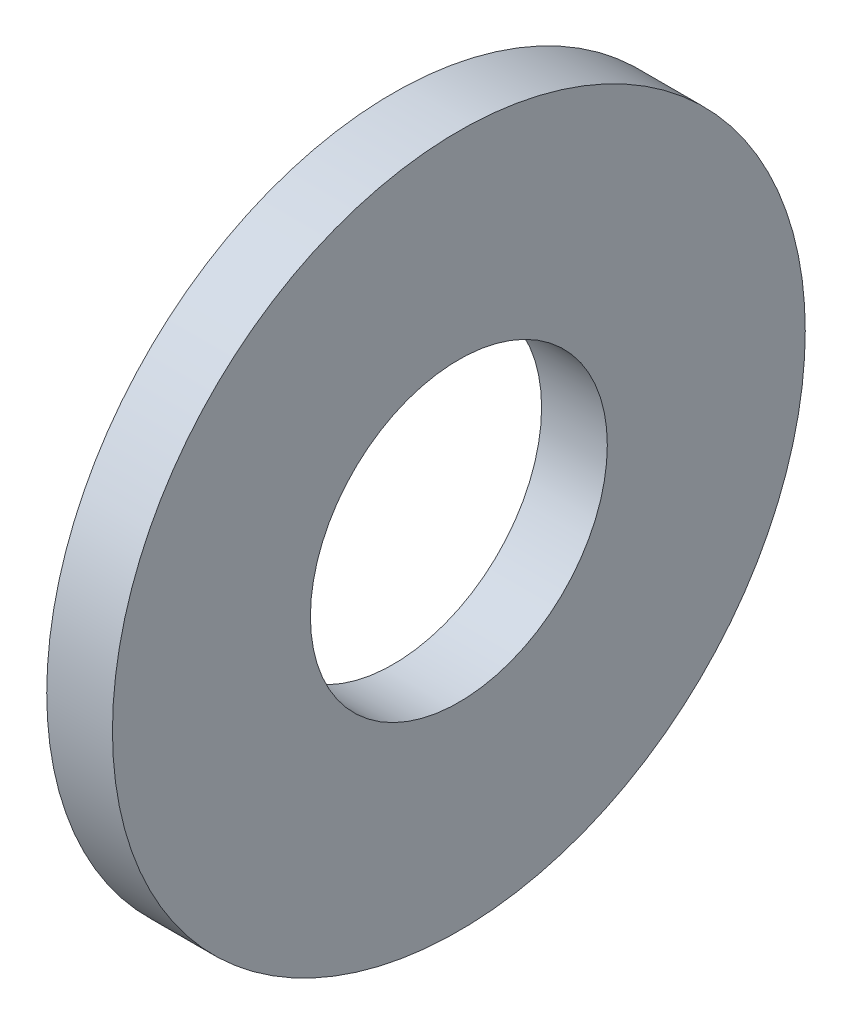
from build123d import *

# Parameters (mm, degrees)
SKETCH1_R           = 11.1125
SKETCH1_R_2         = 4.7625
BOSS_EXTRUDE1_DEPTH = 2.1082


with BuildPart() as part:
    # Sketch1 → Boss-Extrude1 (new body)
    with BuildSketch(Plane(origin=(0, 0, 0), x_dir=(0, 0, -1), z_dir=(1, 0, 0))):
        Circle(SKETCH1_R)
        Circle(SKETCH1_R_2, mode=Mode.SUBTRACT)
    extrude(amount=BOSS_EXTRUDE1_DEPTH)


solid = part.part
